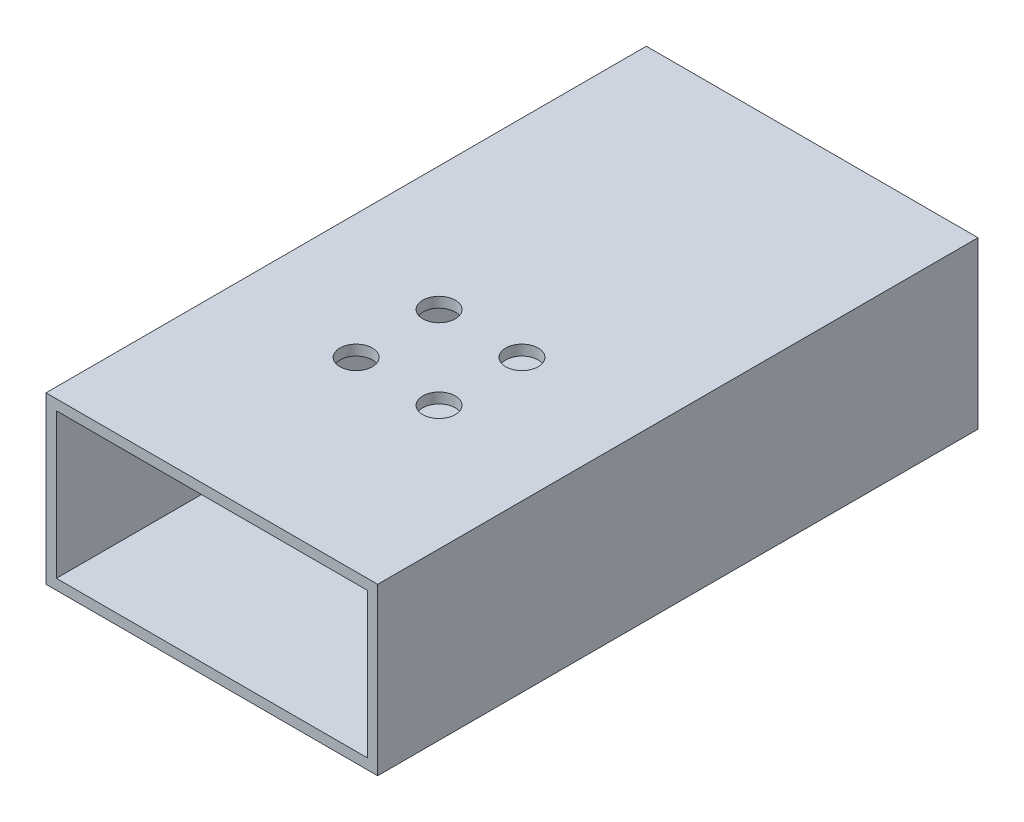
from build123d import *

# Parameters (mm, degrees)
SKETCH1_W           = 50.8
SKETCH1_H           = 25.4
SKETCH1_W_2         = 47.625
SKETCH1_H_2         = 22.225
BOSS_EXTRUDE1_DEPTH = 45.974
SKETCH2_R           = 2.4892
CUT_EXTRUDE1_DEPTH  = 59.343197341


with BuildPart() as part:
    # Sketch1 → Boss-Extrude1 (new, symmetric)
    with BuildSketch(Plane.XY):
        Rectangle(SKETCH1_W, SKETCH1_H)
        Rectangle(SKETCH1_W_2, SKETCH1_H_2, mode=Mode.SUBTRACT)
    extrude(amount=BOSS_EXTRUDE1_DEPTH, both=True)

    # Sketch2 → Cut-Extrude1 (cut, through all)
    with BuildSketch(Plane(origin=(0, 12.7, 0), x_dir=(1, 0, 0), z_dir=(0, 1, 0))):
        with Locations(Location((-6.35, -4.826, 0), (0, 0, 270))):
            Circle(SKETCH2_R)
        with Locations(Location((6.35, -4.826, 0), (0, 0, 270))):
            Circle(SKETCH2_R)
        with Locations(Location((-6.35, -17.526, 0), (0, 0, 270))):
            Circle(SKETCH2_R)
        with Locations(Location((6.35, -17.526, 0), (0, 0, 270))):
            Circle(SKETCH2_R)
    extrude(amount=-CUT_EXTRUDE1_DEPTH, mode=Mode.SUBTRACT)


solid = part.part
